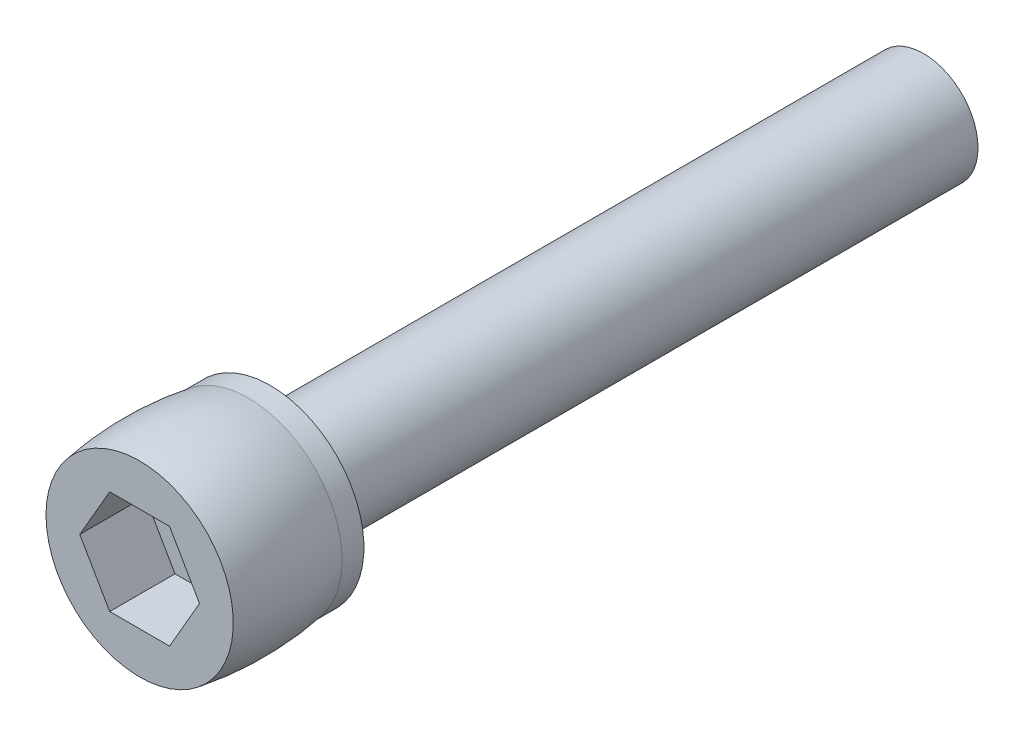
from build123d import *

# Parameters (mm, degrees)
SKETCH1_R           = 1.25
BOSS_EXTRUDE1_DEPTH = 15
SKETCH2_R           = 2.25
BOSS_EXTRUDE2_DEPTH = 3
CUT_EXTRUDE1_DEPTH  = 1.5


with BuildPart() as part:
    # Sketch1 → Boss-Extrude1 (new body)
    with BuildSketch(Plane.XY):
        Circle(SKETCH1_R)
    extrude(amount=-BOSS_EXTRUDE1_DEPTH)

    # Sketch2 → Boss-Extrude2 (add)
    with BuildSketch(Plane.XY):
        Circle(SKETCH2_R)
    extrude(amount=BOSS_EXTRUDE2_DEPTH)

    # Sketch3 → Cut-Revolve1 (revolve, cut)
    with BuildSketch(Plane(origin=(0, 0, 0), x_dir=(0, 0, -1), z_dir=(1, 0, 0)), mode=Mode.PRIVATE) as cut_revolve1_sk:
        with BuildLine():
            Line((-3, 2.15), (-3, 2.75))
            Line((-3, 2.75), (0, 2.75))
            Line((0, 2.75), (0, 2.15))
            Line((0, 2.15), (-0.5, 2.15))
            ThreePointArc((-0.5, 2.15), (-1.75, 2.25), (-3, 2.15))
        make_face()
    revolve(cut_revolve1_sk.sketch.rotate(Axis((0, 0, 3), (0, 0, 1)), 90), axis=Axis((0, 0, 3), (0, 0, 1)), mode=Mode.SUBTRACT)

    # Sketch4 → Cut-Extrude1 (cut)
    with BuildSketch(Plane.XY.offset(3)):
        Polygon((1.374815329, 0), (0.687407664, 1.190625), (-0.687407664, 1.190625), (-1.374815329, 0), (-0.687407664, -1.190625), (0.687407664, -1.190625), align=None)
    extrude(amount=-CUT_EXTRUDE1_DEPTH, mode=Mode.SUBTRACT)


solid = part.part
